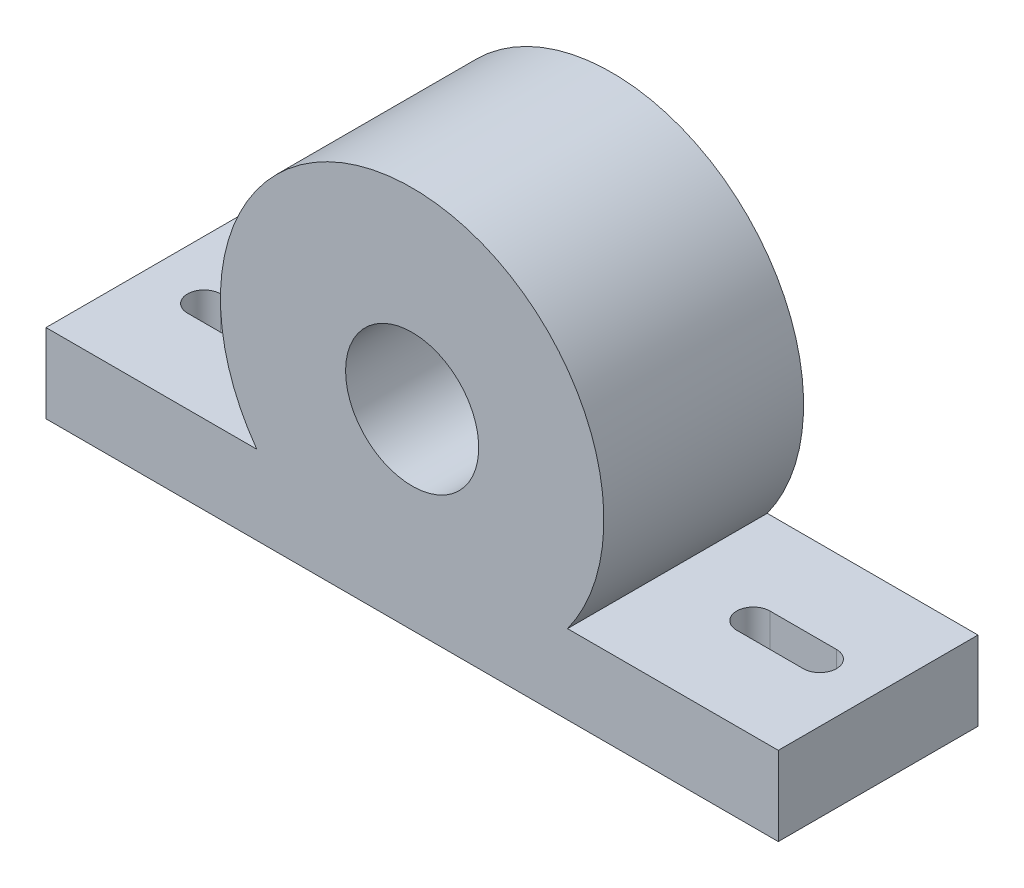
from build123d import *

# Parameters (mm, degrees)
SKETCH2_R           = 12.7
BOSS_EXTRUDE1_DEPTH = 38.1
CUT_EXTRUDE1_DEPTH  = 99.465595781


with BuildPart() as part:
    # Sketch2 → Boss-Extrude1 (new body)
    with BuildSketch(Plane.XY):
        with BuildLine():
            Line((-69.85, -36.5125), (69.85, -36.5125))
            Line((69.85, -36.5125), (69.85, -21.43125))
            Line((69.85, -21.43125), (29.639590069, -21.43125))
            ThreePointArc((29.639590069, -21.43125), (0, 36.576), (-29.639590069, -21.43125))
            Line((-29.639590069, -21.43125), (-69.85, -21.43125))
            Line((-69.85, -21.43125), (-69.85, -36.5125))
        make_face()
        with Locations(Location((0, 0, 0), (0, 0, 180))):
            Circle(SKETCH2_R, mode=Mode.SUBTRACT)
    extrude(amount=BOSS_EXTRUDE1_DEPTH)

    # Sketch3 → Cut-Extrude1 (cut, through all)
    with BuildSketch(Plane(origin=(0, -21.43125, 0), x_dir=(1, 0, 0), z_dir=(0, 1, 0))):
        with BuildLine():
            Line((-58.7375, -15.875), (-46.0375, -15.875))
            ThreePointArc((-46.0375, -15.875), (-42.8625, -19.05), (-46.0375, -22.225))
            Line((-46.0375, -22.225), (-58.7375, -22.225))
            ThreePointArc((-58.7375, -22.225), (-61.9125, -19.05), (-58.7375, -15.875))
        make_face()
    cut_extrude1 = extrude(amount=-CUT_EXTRUDE1_DEPTH, mode=Mode.SUBTRACT)

    # Mirror1: Cut-Extrude1 across plane
    add(cut_extrude1.mirror(Plane(origin=(0, 0, 0), x_dir=(0, 0, 1), z_dir=(1, 0, 0))), mode=Mode.SUBTRACT)


solid = part.part
